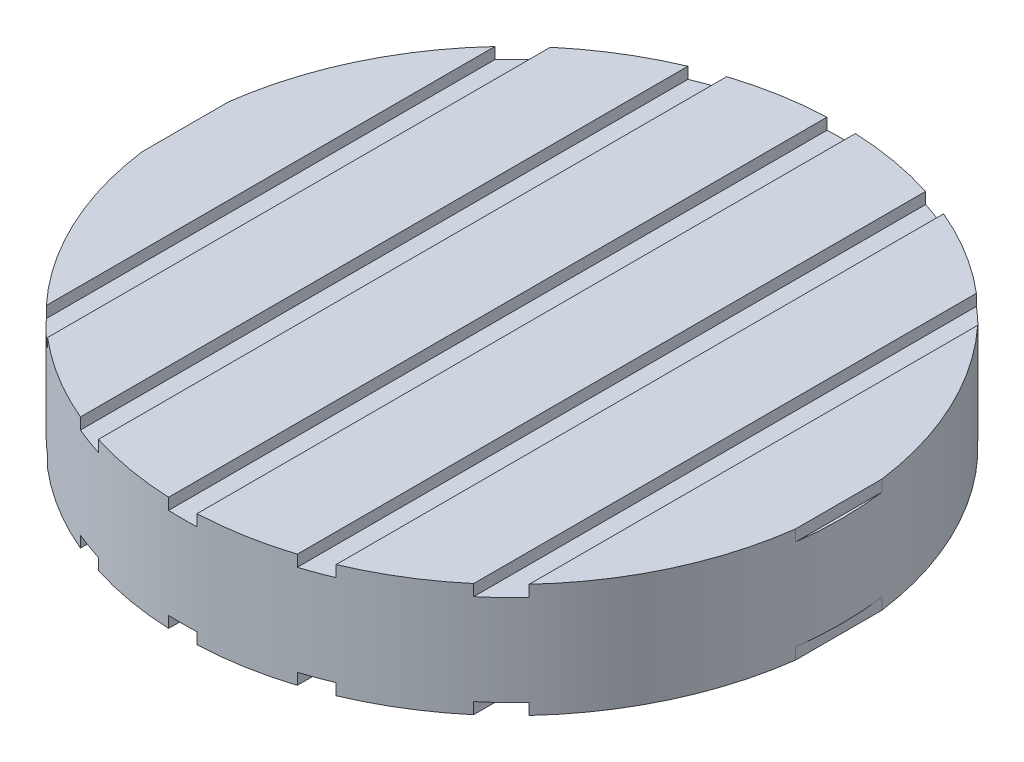
from build123d import *

# Parameters (mm, degrees)
SKETCH1_R           = 2.9
BOSS_EXTRUDE1_DEPTH = 1
SKETCH2_W           = 0.25
SKETCH2_H           = 5.8
CUT_EXTRUDE1_DEPTH  = 0.1


with BuildPart() as part:
    # Sketch1 → Boss-Extrude1 (new body)
    with BuildSketch(Plane(origin=(0, 0, 0), x_dir=(1, 0, 0), z_dir=(0, 1, 0))):
        with Locations(Location((-5.348238854, -2.10463103, 0), (0, 0, 270))):
            Circle(SKETCH1_R)
    extrude(amount=BOSS_EXTRUDE1_DEPTH)

    # Sketch2 → Cut-Extrude1 (cut)
    with BuildSketch(Plane(origin=(0, 1, 0), x_dir=(1, 0, 0), z_dir=(0, 1, 0))):
        with Locations((-10.348238854, -2.10463103)):
            Rectangle(SKETCH2_W, SKETCH2_H)
        with Locations((-11.348238854, -2.10463103)):
            Rectangle(SKETCH2_W, SKETCH2_H)
        with Locations((-9.348238854, -2.10463103)):
            Rectangle(SKETCH2_W, SKETCH2_H)
        with Locations((-8.348238854, -2.10463103)):
            Rectangle(SKETCH2_W, SKETCH2_H)
        with Locations((-7.348238854, -2.10463103)):
            Rectangle(SKETCH2_W, SKETCH2_H)
        with Locations((-6.348238854, -2.10463103)):
            Rectangle(SKETCH2_W, SKETCH2_H)
        with Locations((-5.348238854, -2.10463103)):
            Rectangle(SKETCH2_W, SKETCH2_H)
        with Locations((-4.348238854, -2.10463103)):
            Rectangle(SKETCH2_W, SKETCH2_H)
        with Locations((-3.348238854, -2.10463103)):
            Rectangle(SKETCH2_W, SKETCH2_H)
        with Locations((-2.348238854, -2.10463103)):
            Rectangle(SKETCH2_W, SKETCH2_H)
        with Locations((-1.348238854, -2.10463103)):
            Rectangle(SKETCH2_W, SKETCH2_H)
        with Locations((-0.348238854, -2.10463103)):
            Rectangle(SKETCH2_W, SKETCH2_H)
        with Locations((0.651761146, -2.10463103)):
            Rectangle(SKETCH2_W, SKETCH2_H)
        with Locations((1.651761146, -2.10463103)):
            Rectangle(SKETCH2_W, SKETCH2_H)
        with Locations((2.651761146, -2.10463103)):
            Rectangle(SKETCH2_W, SKETCH2_H)
    cut_extrude1 = extrude(amount=-CUT_EXTRUDE1_DEPTH, mode=Mode.SUBTRACT)

    # Mirror1: Cut-Extrude1 across plane
    add(cut_extrude1.mirror(Plane(origin=(0, 0.5, 0), x_dir=(0, 0, 1), z_dir=(0, -1, 0))), mode=Mode.SUBTRACT)


solid = part.part
